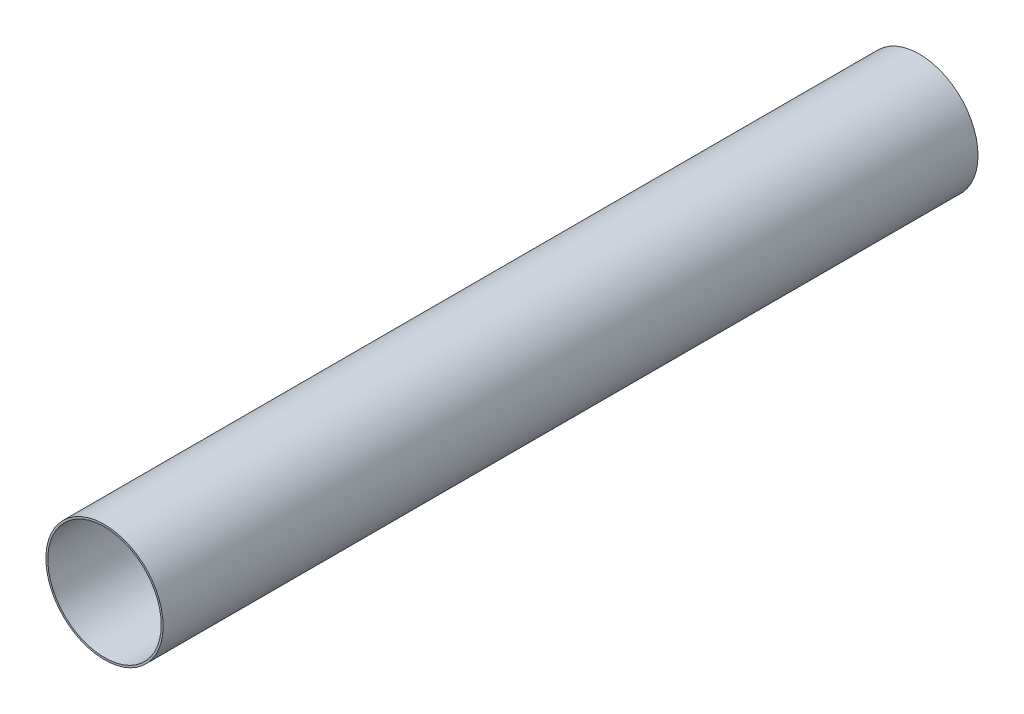
from build123d import *

# Parameters (mm, degrees)
BOSS_EXTRUDE1_DEPTH      = 355.6
BOSS_EXTRUDE1_DEPTH_BACK = 355.6
SKETCH2_R                = 51.15
SKETCH2_R_2              = 49.5


with BuildPart() as part:
    # Sketch2 → Boss-Extrude1 (new, two sides: drawn at the far end of the back side and taken through both)
    with BuildSketch(Plane.XY.offset(-BOSS_EXTRUDE1_DEPTH_BACK)):
        Circle(SKETCH2_R)
        Circle(SKETCH2_R_2, mode=Mode.SUBTRACT)
    extrude(amount=BOSS_EXTRUDE1_DEPTH + BOSS_EXTRUDE1_DEPTH_BACK)


solid = part.part
